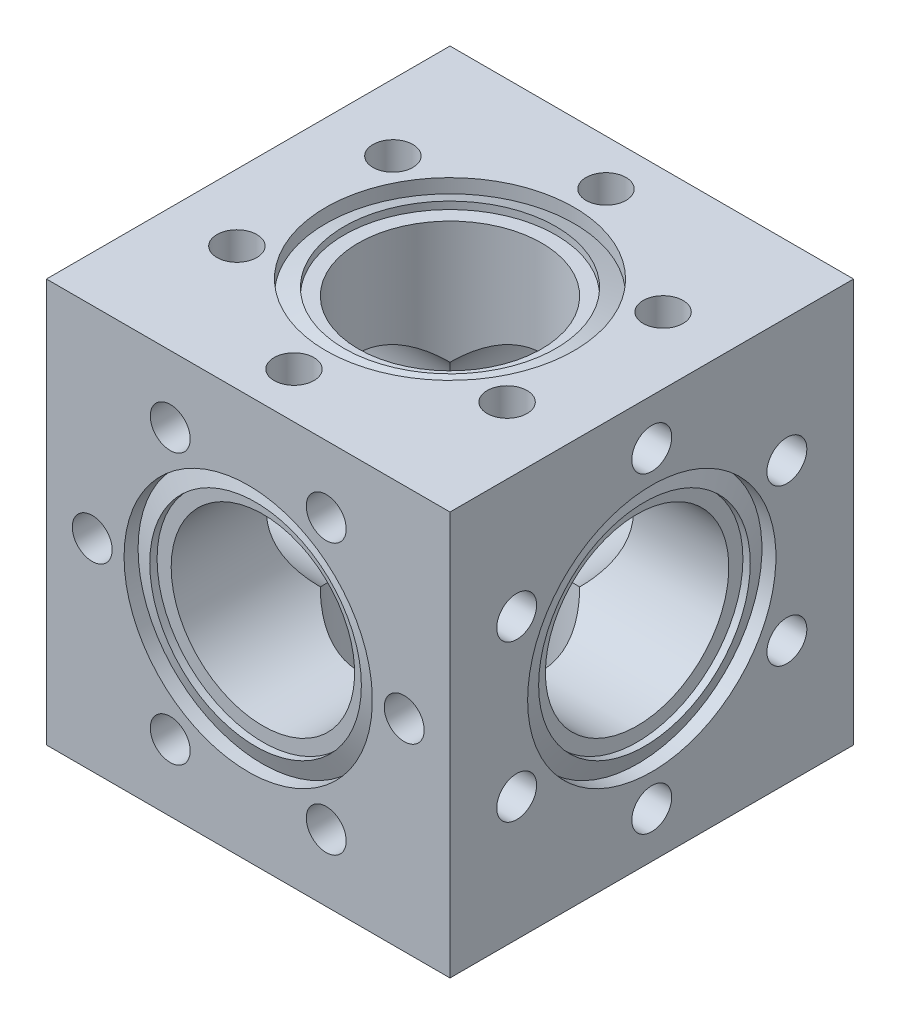
from build123d import *

# Parameters (mm, degrees)
SKETCH1_W           = 34.925
SKETCH1_H           = 34.925
BOSS_EXTRUDE1_DEPTH = 17.4625
CIRPATTERN1_COUNT   = 6
CIRPATTERN2_COUNT   = 6
CIRPATTERN3_COUNT   = 6
CIRPATTERN4_COUNT   = 4
CIRPATTERN5_COUNT   = 4


with BuildPart() as part:
    # Sketch1 → Boss-Extrude1 (new, symmetric)
    with BuildSketch(Plane.XY):
        Rectangle(SKETCH1_W, SKETCH1_H)
    extrude(amount=BOSS_EXTRUDE1_DEPTH, both=True)

    # Sketch6 → Cut-Revolve1 (revolve, cut)
    with BuildSketch(Plane.XY):
        Polygon((17.4625, 10.7442), (16.249697253, 10.7442), (16.8275, 9.1567), (16.1925, 9.1567), (16.1925, 7.9375), (0, 7.9375), (0, 0), (17.4625, 0), align=None)
    cut_revolve1 = revolve(axis=Axis((17.4625, 0, 0), (1, 0, 0)), mode=Mode.SUBTRACT)

    # Sketch5 → Tapped Hole0 (revolve, cut)
    with BuildSketch(Plane(origin=(17.4625, 13.5001, 0), x_dir=(0, 0, -1), z_dir=(0, 1, 0))):
        Polygon((0, 0), (0, 7.387806428), (1.727199945, 6.35), (1.727199945, 0), align=None)
    tapped_hole0 = revolve(axis=Axis((23.8125, 13.5001, 0), (-1, 0, 0)), mode=Mode.SUBTRACT)

    # Sketch8 → Tapped Hole1 (revolve, cut)
    with BuildSketch(Plane(origin=(0, 17.4625, -13.5001), x_dir=(0, 0, 1), z_dir=(1, 0, 0))):
        Polygon((0, 0), (0, 7.387806428), (1.727199945, 6.35), (1.727199945, 0), align=None)
    tapped_hole1 = revolve(axis=Axis((0, 23.8125, -13.5001), (0, -1, 0)), mode=Mode.SUBTRACT)

    # Sketch10 → Tapped Hole2 (revolve, cut)
    with BuildSketch(Plane(origin=(13.5001, 0, 17.4625), x_dir=(0, -1, 0), z_dir=(1, 0, 0))):
        Polygon((0, 0), (0, 7.387806428), (1.727199945, 6.35), (1.727199945, 0), align=None)
    tapped_hole2 = revolve(axis=Axis((13.5001, 0, 23.8125), (0, 0, -1)), mode=Mode.SUBTRACT)

    # CirPattern1: Tapped Hole0 ×6 about axis
    cirpattern1_axis = Axis((-38.4175, 0, 0), (1, 0, 0))
    for i in range(1, CIRPATTERN1_COUNT):
        add(tapped_hole0.rotate(cirpattern1_axis, i * 360 / CIRPATTERN1_COUNT), mode=Mode.SUBTRACT)

    # CirPattern2: Tapped Hole1 ×6 about axis
    cirpattern2_axis = Axis((0, 38.4175, 0), (0, -1, 0))
    for i in range(1, CIRPATTERN2_COUNT):
        add(tapped_hole1.rotate(cirpattern2_axis, i * 360 / CIRPATTERN2_COUNT), mode=Mode.SUBTRACT)

    # CirPattern3: Tapped Hole2 ×6 about axis
    cirpattern3_axis = Axis((0, 0, 38.4175), (0, 0, -1))
    for i in range(1, CIRPATTERN3_COUNT):
        add(tapped_hole2.rotate(cirpattern3_axis, i * 360 / CIRPATTERN3_COUNT), mode=Mode.SUBTRACT)

    # CirPattern4: Cut-Revolve1 ×4 about axis
    cirpattern4_axis = Axis((0, 38.4175, 0), (0, -1, 0))
    for i in range(1, CIRPATTERN4_COUNT):
        add(cut_revolve1.rotate(cirpattern4_axis, i * 360 / CIRPATTERN4_COUNT), mode=Mode.SUBTRACT)

    # CirPattern5: Cut-Revolve1 ×4 about axis, 1 skipped
    cirpattern5_axis = Axis((0, 0, 38.4175), (0, 0, -1))
    add([cut_revolve1.rotate(cirpattern5_axis, i * 360 / CIRPATTERN5_COUNT) for i in range(1, CIRPATTERN5_COUNT) if i not in (2,)], mode=Mode.SUBTRACT)

    # Mirror1 copy 1 sketch → Mirror1 copy 1 (revolve, cut)
    with BuildSketch(Plane(origin=(6.75005, -11.691429554, -17.4625), x_dir=(-0.8660254037844386, -0.5000000000000001, 0), z_dir=(0.5000000000000001, -0.8660254037844386, 0))):
        Polygon((0, 0), (0, -7.387806428), (1.727199945, -6.35), (1.727199945, 0), align=None)
    revolve(axis=Axis((6.75005, -11.691429554, -23.8125), (0, 0, -1)), mode=Mode.SUBTRACT)

    # Mirror1 copy 2 sketch → Mirror1 copy 2 (revolve, cut)
    with BuildSketch(Plane(origin=(-6.75005, -11.691429554, -17.4625), x_dir=(-0.8660254037844387, 0.4999999999999998, 0), z_dir=(-0.4999999999999998, -0.8660254037844387, 0))):
        Polygon((0, 0), (0, -7.387806428), (1.727199945, -6.35), (1.727199945, 0), align=None)
    revolve(axis=Axis((-6.75005, -11.691429554, -23.8125), (0, 0, -1)), mode=Mode.SUBTRACT)

    # Mirror1 copy 3 sketch → Mirror1 copy 3 (revolve, cut)
    with BuildSketch(Plane(origin=(-13.5001, 0, -17.4625), x_dir=(0, 1, 0), z_dir=(-1, 0, 0))):
        Polygon((0, 0), (0, -7.387806428), (1.727199945, -6.35), (1.727199945, 0), align=None)
    revolve(axis=Axis((-13.5001, 0, -23.8125), (0, 0, -1)), mode=Mode.SUBTRACT)

    # Mirror1 copy 4 sketch → Mirror1 copy 4 (revolve, cut)
    with BuildSketch(Plane(origin=(-6.75005, 11.691429554, -17.4625), x_dir=(0.8660254037844384, 0.5000000000000004, 0), z_dir=(-0.5000000000000004, 0.8660254037844384, 0))):
        Polygon((0, 0), (0, -7.387806428), (1.727199945, -6.35), (1.727199945, 0), align=None)
    revolve(axis=Axis((-6.75005, 11.691429554, -23.8125), (0, 0, -1)), mode=Mode.SUBTRACT)

    # Mirror1 copy 5 sketch → Mirror1 copy 5 (revolve, cut)
    with BuildSketch(Plane(origin=(6.75005, 11.691429554, -17.4625), x_dir=(0.8660254037844386, -0.5000000000000001, 0), z_dir=(0.5000000000000001, 0.8660254037844386, 0))):
        Polygon((0, 0), (0, -7.387806428), (1.727199945, -6.35), (1.727199945, 0), align=None)
    revolve(axis=Axis((6.75005, 11.691429554, -23.8125), (0, 0, -1)), mode=Mode.SUBTRACT)

    # Mirror1 copy 6 sketch → Mirror1 copy 6 (revolve, cut)
    with BuildSketch(Plane(origin=(13.5001, 0, -17.4625), x_dir=(0, -1, 0), z_dir=(1, 0, 0))):
        Polygon((0, 0), (0, -7.387806428), (1.727199945, -6.35), (1.727199945, 0), align=None)
    revolve(axis=Axis((13.5001, 0, -23.8125), (0, 0, -1)), mode=Mode.SUBTRACT)

    # Mirror2 copy 1 sketch → Mirror2 copy 1 (revolve, cut)
    with BuildSketch(Plane(origin=(11.691429554, -17.4625, -6.75005), x_dir=(-0.8660254037844386, 0, 0.5000000000000001), z_dir=(0.5000000000000001, 0, 0.8660254037844386))):
        Polygon((0, 0), (0, -7.387806428), (1.727199945, -6.35), (1.727199945, 0), align=None)
    revolve(axis=Axis((11.691429554, -23.8125, -6.75005), (0, -1, 0)), mode=Mode.SUBTRACT)

    # Mirror2 copy 2 sketch → Mirror2 copy 2 (revolve, cut)
    with BuildSketch(Plane(origin=(11.691429554, -17.4625, 6.75005), x_dir=(-0.8660254037844387, 0, -0.4999999999999998), z_dir=(-0.4999999999999998, 0, 0.8660254037844387))):
        Polygon((0, 0), (0, -7.387806428), (1.727199945, -6.35), (1.727199945, 0), align=None)
    revolve(axis=Axis((11.691429554, -23.8125, 6.75005), (0, -1, 0)), mode=Mode.SUBTRACT)

    # Mirror2 copy 3 sketch → Mirror2 copy 3 (revolve, cut)
    with BuildSketch(Plane(origin=(0, -17.4625, 13.5001), x_dir=(0, 0, -1), z_dir=(-1, 0, 0))):
        Polygon((0, 0), (0, -7.387806428), (1.727199945, -6.35), (1.727199945, 0), align=None)
    revolve(axis=Axis((0, -23.8125, 13.5001), (0, -1, 0)), mode=Mode.SUBTRACT)

    # Mirror2 copy 4 sketch → Mirror2 copy 4 (revolve, cut)
    with BuildSketch(Plane(origin=(-11.691429554, -17.4625, 6.75005), x_dir=(0.8660254037844384, 0, -0.5000000000000004), z_dir=(-0.5000000000000004, 0, -0.8660254037844384))):
        Polygon((0, 0), (0, -7.387806428), (1.727199945, -6.35), (1.727199945, 0), align=None)
    revolve(axis=Axis((-11.691429554, -23.8125, 6.75005), (0, -1, 0)), mode=Mode.SUBTRACT)

    # Mirror2 copy 5 sketch → Mirror2 copy 5 (revolve, cut)
    with BuildSketch(Plane(origin=(-11.691429554, -17.4625, -6.75005), x_dir=(0.8660254037844386, 0, 0.5000000000000001), z_dir=(0.5000000000000001, 0, -0.8660254037844386))):
        Polygon((0, 0), (0, -7.387806428), (1.727199945, -6.35), (1.727199945, 0), align=None)
    revolve(axis=Axis((-11.691429554, -23.8125, -6.75005), (0, -1, 0)), mode=Mode.SUBTRACT)

    # Mirror2 copy 6 sketch → Mirror2 copy 6 (revolve, cut)
    with BuildSketch(Plane(origin=(0, -17.4625, -13.5001), x_dir=(0, 0, 1), z_dir=(1, 0, 0))):
        Polygon((0, 0), (0, -7.387806428), (1.727199945, -6.35), (1.727199945, 0), align=None)
    revolve(axis=Axis((0, -23.8125, -13.5001), (0, -1, 0)), mode=Mode.SUBTRACT)

    # Mirror3 copy 1 sketch → Mirror3 copy 1 (revolve, cut)
    with BuildSketch(Plane(origin=(-17.4625, 6.75005, 11.691429554), x_dir=(0, 0.8660254037844386, -0.5000000000000001), z_dir=(0, 0.5000000000000001, 0.8660254037844386))):
        Polygon((0, 0), (0, -7.387806428), (1.727199945, -6.35), (1.727199945, 0), align=None)
    revolve(axis=Axis((-23.8125, 6.75005, 11.691429554), (-1, 0, 0)), mode=Mode.SUBTRACT)

    # Mirror3 copy 2 sketch → Mirror3 copy 2 (revolve, cut)
    with BuildSketch(Plane(origin=(-17.4625, -6.75005, 11.691429554), x_dir=(0, 0.8660254037844387, 0.4999999999999998), z_dir=(0, -0.4999999999999998, 0.8660254037844387))):
        Polygon((0, 0), (0, -7.387806428), (1.727199945, -6.35), (1.727199945, 0), align=None)
    revolve(axis=Axis((-23.8125, -6.75005, 11.691429554), (-1, 0, 0)), mode=Mode.SUBTRACT)

    # Mirror3 copy 3 sketch → Mirror3 copy 3 (revolve, cut)
    with BuildSketch(Plane(origin=(-17.4625, -13.5001, 0), x_dir=(0, 0, 1), z_dir=(0, -1, 0))):
        Polygon((0, 0), (0, -7.387806428), (1.727199945, -6.35), (1.727199945, 0), align=None)
    revolve(axis=Axis((-23.8125, -13.5001, 0), (-1, 0, 0)), mode=Mode.SUBTRACT)

    # Mirror3 copy 4 sketch → Mirror3 copy 4 (revolve, cut)
    with BuildSketch(Plane(origin=(-17.4625, -6.75005, -11.691429554), x_dir=(0, -0.8660254037844384, 0.5000000000000004), z_dir=(0, -0.5000000000000004, -0.8660254037844384))):
        Polygon((0, 0), (0, -7.387806428), (1.727199945, -6.35), (1.727199945, 0), align=None)
    revolve(axis=Axis((-23.8125, -6.75005, -11.691429554), (-1, 0, 0)), mode=Mode.SUBTRACT)

    # Mirror3 copy 5 sketch → Mirror3 copy 5 (revolve, cut)
    with BuildSketch(Plane(origin=(-17.4625, 6.75005, -11.691429554), x_dir=(0, -0.8660254037844386, -0.5000000000000001), z_dir=(0, 0.5000000000000001, -0.8660254037844386))):
        Polygon((0, 0), (0, -7.387806428), (1.727199945, -6.35), (1.727199945, 0), align=None)
    revolve(axis=Axis((-23.8125, 6.75005, -11.691429554), (-1, 0, 0)), mode=Mode.SUBTRACT)

    # Mirror3 copy 6 sketch → Mirror3 copy 6 (revolve, cut)
    with BuildSketch(Plane(origin=(-17.4625, 13.5001, 0), x_dir=(0, 0, -1), z_dir=(0, 1, 0))):
        Polygon((0, 0), (0, -7.387806428), (1.727199945, -6.35), (1.727199945, 0), align=None)
    revolve(axis=Axis((-23.8125, 13.5001, 0), (-1, 0, 0)), mode=Mode.SUBTRACT)


solid = part.part
